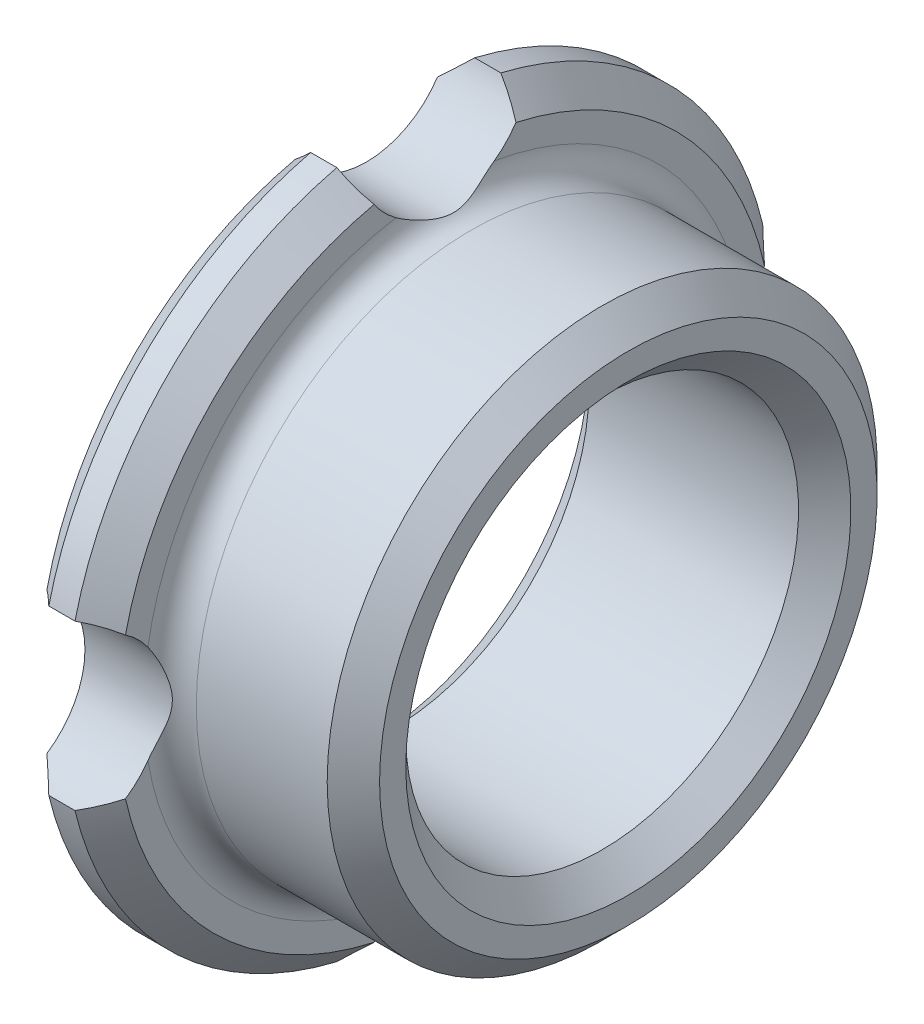
from build123d import *

# Parameters (mm, degrees)
CHAMFER1_SIZE      = 1
FILLET1_R          = 1
SKETCH2_R          = 3.25
CUT_EXTRUDE1_DEPTH = 10


with BuildPart() as part:
    # Sketch1 → Revolve1 (revolve)
    with BuildSketch(Plane.XY, mode=Mode.PRIVATE) as revolve1_sk:
        Polygon((0, 7.5), (10, 7.5), (10, 10.5), (3, 10.5), (3, 13.5), (0, 13.5), align=None)
    revolve(revolve1_sk.sketch.rotate(Axis((0, 0, 0), (1, 0, 0)), 90), axis=Axis((0, 0, 0), (1, 0, 0)))

    # Chamfer1
    chamfer1_edges = [part.edges().sort_by_distance(p)[0] for p in [
        (0, 0, -13.5),
        (3, 0, -13.5),
        (10, 0, -10.5),
        (10, 0, -7.5),
        (0, 0, -7.5),
    ]]
    chamfer(chamfer1_edges, length=CHAMFER1_SIZE)

    # Fillet1
    fillet1_edges = [part.edges().sort_by_distance(p)[0] for p in [
        (3, 0, -10.5),
    ]]
    fillet(fillet1_edges, radius=FILLET1_R)

    # Sketch2 → Cut-Extrude1 (cut)
    with BuildSketch(Plane.ZY):
        with Locations((0, 14)):
            Circle(SKETCH2_R)
        with Locations((-14, 0)):
            Circle(SKETCH2_R)
        with Locations((0, -14)):
            Circle(SKETCH2_R)
        with Locations((14, 0)):
            Circle(SKETCH2_R)
    extrude(amount=-CUT_EXTRUDE1_DEPTH, mode=Mode.SUBTRACT)


solid = part.part
